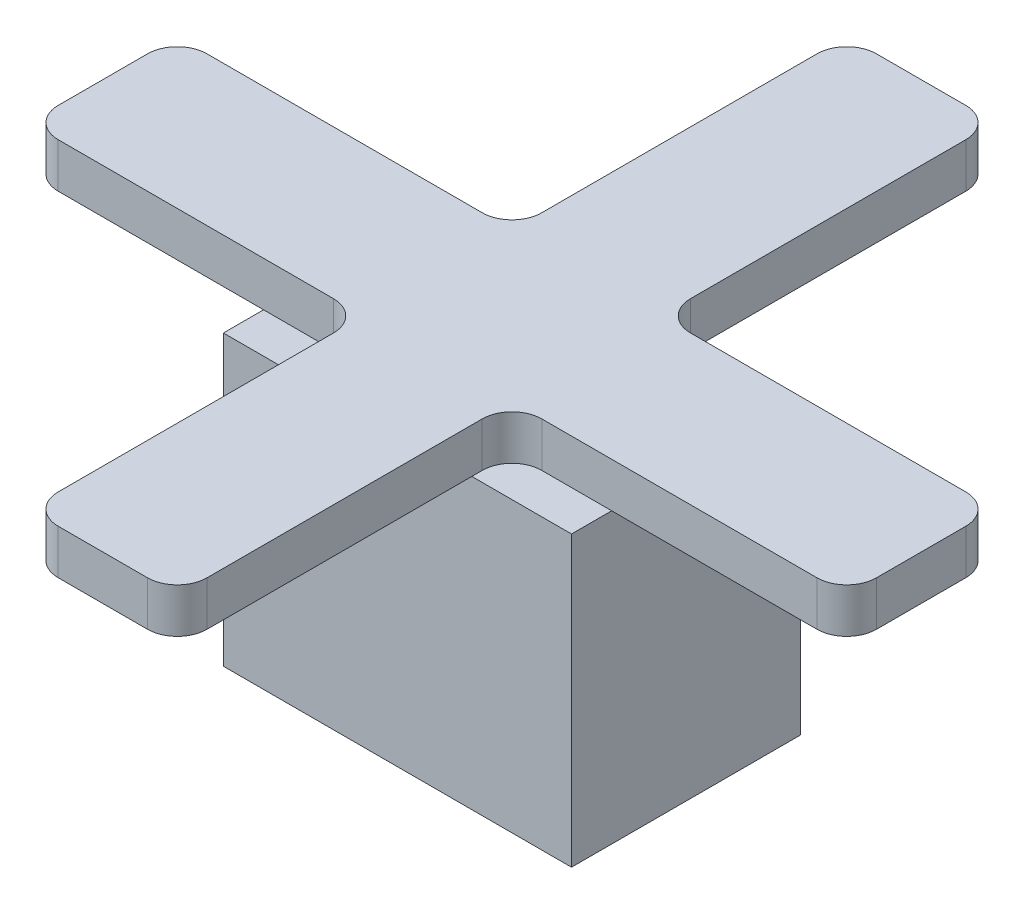
from build123d import *

# Parameters (mm, degrees)
EXTRUDE_1_DEPTH = 3
SKETCH_2_W      = 23.4
SKETCH_2_H      = 15.4
EXTRUDE_2_DEPTH = 3
SKETCH_4_W      = 23.4
SKETCH_4_H      = 15.4
SKETCH_4_W_2    = 20.4
SKETCH_4_H_2    = 12.4
EXTRUDE_4_DEPTH = 16.4


with BuildPart() as part:
    # 草图1 → 凸台-拉伸1 (new body)
    with BuildSketch(Plane(origin=(0, 0, 0), x_dir=(1, 0, 0), z_dir=(0, 1, 0))):
        with BuildLine():
            Line((7, 5), (25.5, 5))
            ThreePointArc((25.5, 5), (26.914213562, 4.414213562), (27.5, 3))
            Line((27.5, 3), (27.5, -3))
            ThreePointArc((27.5, -3), (26.914213562, -4.414213562), (25.5, -5))
            Line((25.5, -5), (7, -5))
            ThreePointArc((7, -5), (5.585786438, -5.585786438), (5, -7))
            Line((5, -7), (5, -25.5))
            ThreePointArc((5, -25.5), (4.414213562, -26.914213562), (3, -27.5))
            Line((3, -27.5), (-3, -27.5))
            ThreePointArc((-3, -27.5), (-4.414213562, -26.914213562), (-5, -25.5))
            Line((-5, -25.5), (-5, -7))
            ThreePointArc((-5, -7), (-5.585786438, -5.585786438), (-7, -5))
            Line((-7, -5), (-25.5, -5))
            ThreePointArc((-25.5, -5), (-26.914213562, -4.414213562), (-27.5, -3))
            Line((-27.5, -3), (-27.5, 3))
            ThreePointArc((-27.5, 3), (-26.914213562, 4.414213562), (-25.5, 5))
            Line((-25.5, 5), (-7, 5))
            ThreePointArc((-7, 5), (-5.585786438, 5.585786438), (-5, 7))
            Line((-5, 7), (-5, 25.5))
            ThreePointArc((-5, 25.5), (-4.414213562, 26.914213562), (-3, 27.5))
            Line((-3, 27.5), (3, 27.5))
            ThreePointArc((3, 27.5), (4.414213562, 26.914213562), (5, 25.5))
            Line((5, 25.5), (5, 7))
            ThreePointArc((5, 7), (5.585786438, 5.585786438), (7, 5))
        make_face()
    extrude(amount=EXTRUDE_1_DEPTH)

    # 草图2 → 凸台-拉伸2 (add)
    with BuildSketch(Plane.XZ):
        Rectangle(SKETCH_2_W, SKETCH_2_H)
    extrude(amount=EXTRUDE_2_DEPTH)

    # 草图4 → 凸台-拉伸4 (add)
    with BuildSketch(Plane.XZ.offset(3)):
        Rectangle(SKETCH_4_W, SKETCH_4_H)
        Rectangle(SKETCH_4_W_2, SKETCH_4_H_2, mode=Mode.SUBTRACT)
    extrude(amount=EXTRUDE_4_DEPTH)


solid = part.part
